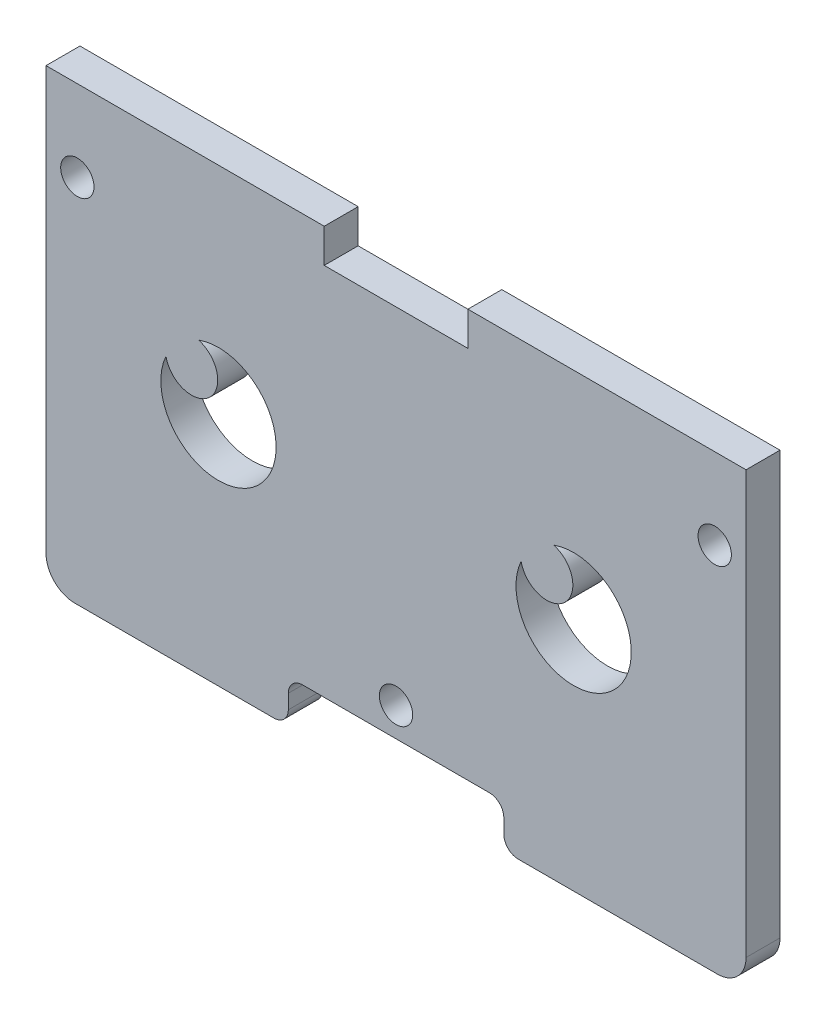
from build123d import *

# Parameters (mm, degrees)
SKETCH1_W                   = 61.88
SKETCH1_H                   = 39.878
BOSS_EXTRUDE1_DEPTH         = 3
F_32_0_116_DIAMETER_HOLE1_D = 2.9464
FILLET1_R                   = 2.54
SKETCH6_W                   = 12.7
SKETCH6_H                   = 3
CUT_EXTRUDE1_DEPTH          = 3
SKETCH7_W                   = 19.05
SKETCH7_H                   = 3.81
CUT_EXTRUDE2_DEPTH          = 74.67760368
FILLET2_R                   = 1.27
CUT_EXTRUDE4_DEPTH          = 3


with BuildPart() as part:
    # Sketch1 → Boss-Extrude1 (new body)
    with BuildSketch(Plane.XY):
        with Locations((30.94, 19.939)):
            Rectangle(SKETCH1_W, SKETCH1_H)
    extrude(amount=BOSS_EXTRUDE1_DEPTH)

    # #32 (0.116) Diameter Hole1 (through all)
    with Locations(Plane.XY.offset(3)):
        with Locations((30.94, 6.373999952), (59.11, 32.7152), (2.77, 32.7152)):
            Hole(F_32_0_116_DIAMETER_HOLE1_D / 2)

    # Fillet1
    fillet1_edges = [part.edges().sort_by_distance(p)[0] for p in [
        (61.88, 0, 1.5),
        (0, 0, 1.5),
    ]]
    fillet(fillet1_edges, radius=FILLET1_R)

    # Sketch6 → Cut-Extrude1 (cut)
    with BuildSketch(Plane(origin=(0, 0, 0), x_dir=(-1, 0, 0), z_dir=(0, 0, -1))):
        with Locations((-30.9428, 38.378)):
            Rectangle(SKETCH6_W, SKETCH6_H)
    extrude(amount=-CUT_EXTRUDE1_DEPTH, mode=Mode.SUBTRACT)

    # Sketch7 → Cut-Extrude2 (cut, through all)
    with BuildSketch(Plane(origin=(0, 0, 0), x_dir=(-1, 0, 0), z_dir=(0, 0, -1))):
        with Locations((-30.9428, 1.905)):
            Rectangle(SKETCH7_W, SKETCH7_H)
    extrude(amount=-CUT_EXTRUDE2_DEPTH, mode=Mode.SUBTRACT)

    # Fillet2
    fillet2_edges = [part.edges().sort_by_distance(p)[0] for p in [
        (40.4678, 0, 1.5),
        (40.4678, 3.81, 1.5),
        (21.4178, 3.81, 1.5),
        (21.4178, 0, 1.5),
    ]]
    fillet(fillet2_edges, radius=FILLET2_R)

    # Sketch10 → Cut-Extrude4 (cut)
    with BuildSketch(Plane(origin=(0, 0, 0), x_dir=(-1, 0, 0), z_dir=(0, 0, -1))):
        with BuildLine():
            ThreePointArc((-10.60427198, 22.930843482), (-18.715027328, 17.096117028), (-13.486198066, 25.610089641))
            ThreePointArc((-13.486198066, 25.610089641), (-14.439521527, 21.695056792), (-10.60427198, 22.930843482))
        make_face()
        with BuildLine():
            ThreePointArc((-41.99867198, 22.930843482), (-45.833921527, 21.695056792), (-44.880598066, 25.610089641))
            ThreePointArc((-44.880598066, 25.610089641), (-50.109427328, 17.096117028), (-41.99867198, 22.930843482))
        make_face()
    extrude(amount=-CUT_EXTRUDE4_DEPTH, mode=Mode.SUBTRACT)


solid = part.part
